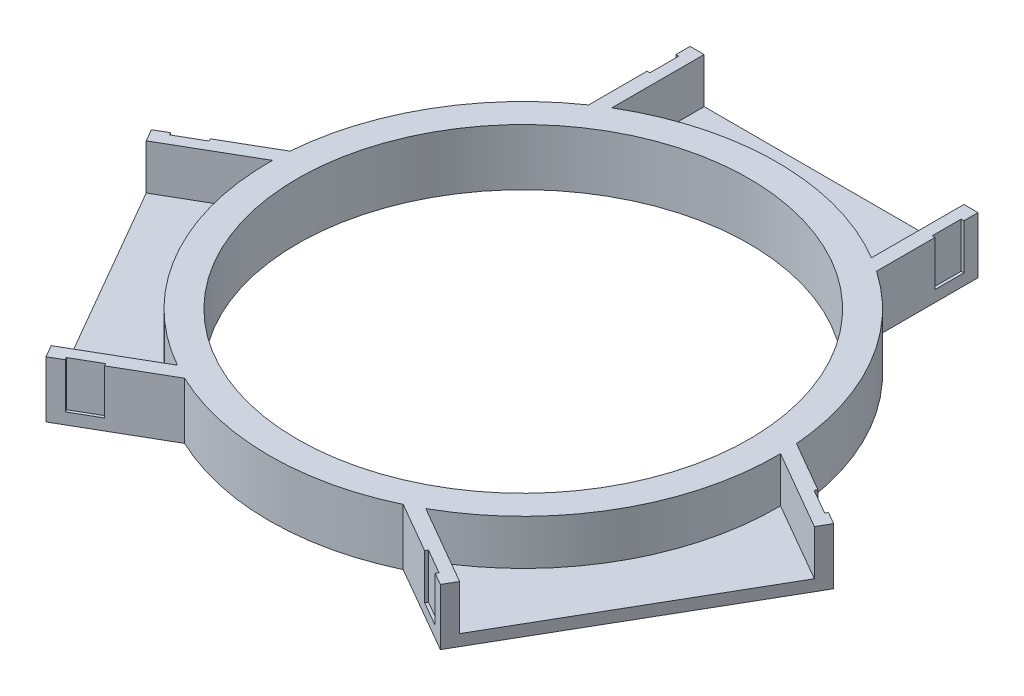
from build123d import *

# Parameters (mm, degrees)
SKETCH1_R           = 40
BOSS_EXTRUDE1_DEPTH = 10
SKETCH2_R           = 40
BOSS_EXTRUDE2_DEPTH = 2


with BuildPart() as part:
    # Sketch1 → Boss-Extrude1 (new body)
    with BuildSketch(Plane(origin=(0, 0, 0), x_dir=(1, 0, 0), z_dir=(0, 1, 0))):
        with BuildLine():
            Line((-25.5, 37.077621283), (-25.5, 47.45))
            Line((-25.5, 47.45), (-25, 47.45))
            Line((-25, 47.45), (-25, 52.55))
            Line((-25, 52.55), (-25.5, 52.55))
            Line((-25.5, 52.55), (-25.5, 55.05))
            Line((-25.5, 55.05), (-23, 55.05))
            Line((-23, 55.05), (-23, 38.678159212))
            ThreePointArc((-23, 38.678159212), (0, 45), (23, 38.678159212))
            Line((23, 38.678159212), (23, 55.05))
            Line((23, 55.05), (25.5, 55.05))
            Line((25.5, 55.05), (25.5, 52.55))
            Line((25.5, 52.55), (25, 52.55))
            Line((25, 52.55), (25, 47.45))
            Line((25, 47.45), (25.5, 47.45))
            Line((25.5, 47.45), (25.5, 37.077621283))
            ThreePointArc((25.5, 37.077621283), (38.97114317, 22.5), (44.860161943, 3.544837155))
            Line((44.860161943, 3.544837155), (53.84290541, -1.641352203))
            Line((53.84290541, -1.641352203), (53.59290541, -2.074364905))
            Line((53.59290541, -2.074364905), (58.009634969, -4.624364905))
            Line((58.009634969, -4.624364905), (58.259634969, -4.191352203))
            Line((58.259634969, -4.191352203), (60.424698478, -5.441352203))
            Line((60.424698478, -5.441352203), (59.174698478, -7.606415713))
            Line((59.174698478, -7.606415713), (44.996268449, 0.579504681))
            ThreePointArc((44.996268449, 0.579504681), (38.97114317, -22.5), (21.996268449, -39.257663893))
            Line((21.996268449, -39.257663893), (36.174698478, -47.443584287))
            Line((36.174698478, -47.443584287), (34.924698478, -49.608647797))
            Line((34.924698478, -49.608647797), (32.759634969, -48.358647797))
            Line((32.759634969, -48.358647797), (33.009634969, -47.925635095))
            Line((33.009634969, -47.925635095), (28.59290541, -45.375635095))
            Line((28.59290541, -45.375635095), (28.34290541, -45.808647797))
            Line((28.34290541, -45.808647797), (19.360161943, -40.622458438))
            ThreePointArc((19.360161943, -40.622458438), (0, -45), (-19.360161943, -40.622458438))
            Line((-19.360161943, -40.622458438), (-28.34290541, -45.808647797))
            Line((-28.34290541, -45.808647797), (-28.59290541, -45.375635095))
            Line((-28.59290541, -45.375635095), (-33.009634969, -47.925635095))
            Line((-33.009634969, -47.925635095), (-32.759634969, -48.358647797))
            Line((-32.759634969, -48.358647797), (-34.924698478, -49.608647797))
            Line((-34.924698478, -49.608647797), (-36.174698478, -47.443584287))
            Line((-36.174698478, -47.443584287), (-21.996268449, -39.257663893))
            ThreePointArc((-21.996268449, -39.257663893), (-38.97114317, -22.5), (-44.996268449, 0.579504681))
            Line((-44.996268449, 0.579504681), (-59.174698478, -7.606415713))
            Line((-59.174698478, -7.606415713), (-60.424698478, -5.441352203))
            Line((-60.424698478, -5.441352203), (-58.259634969, -4.191352203))
            Line((-58.259634969, -4.191352203), (-58.009634969, -4.624364905))
            Line((-58.009634969, -4.624364905), (-53.59290541, -2.074364905))
            Line((-53.59290541, -2.074364905), (-53.84290541, -1.641352203))
            Line((-53.84290541, -1.641352203), (-44.860161943, 3.544837155))
            ThreePointArc((-44.860161943, 3.544837155), (-38.97114317, 22.5), (-25.5, 37.077621283))
        make_face()
        with Locations(Location((0, 0, 0), (0, 0, 270))):
            Circle(SKETCH1_R, mode=Mode.SUBTRACT)
    extrude(amount=BOSS_EXTRUDE1_DEPTH)

    # Sketch2 → Boss-Extrude2 (add)
    with BuildSketch(Plane.XZ):
        with BuildLine():
            Line((-60.424698478, 5.441352203), (-34.924698478, 49.608647797))
            Line((-34.924698478, 49.608647797), (-19.360161943, 40.622458438))
            ThreePointArc((-19.360161943, 40.622458438), (0, 45), (19.360161943, 40.622458438))
            Line((19.360161943, 40.622458438), (34.924698478, 49.608647797))
            Line((34.924698478, 49.608647797), (60.424698478, 5.441352203))
            Line((60.424698478, 5.441352203), (44.860161943, -3.544837155))
            ThreePointArc((44.860161943, -3.544837155), (38.97114317, -22.5), (25.5, -37.077621283))
            Line((25.5, -37.077621283), (25.5, -55.05))
            Line((25.5, -55.05), (-25.5, -55.05))
            Line((-25.5, -55.05), (-25.5, -37.077621283))
            ThreePointArc((-25.5, -37.077621283), (-38.97114317, -22.5), (-44.860161943, -3.544837155))
            Line((-44.860161943, -3.544837155), (-60.424698478, 5.441352203))
        make_face()
        with Locations(Location((0, 0, 0), (0, 0, 90))):
            Circle(SKETCH2_R, mode=Mode.SUBTRACT)
    extrude(amount=-BOSS_EXTRUDE2_DEPTH)


solid = part.part
